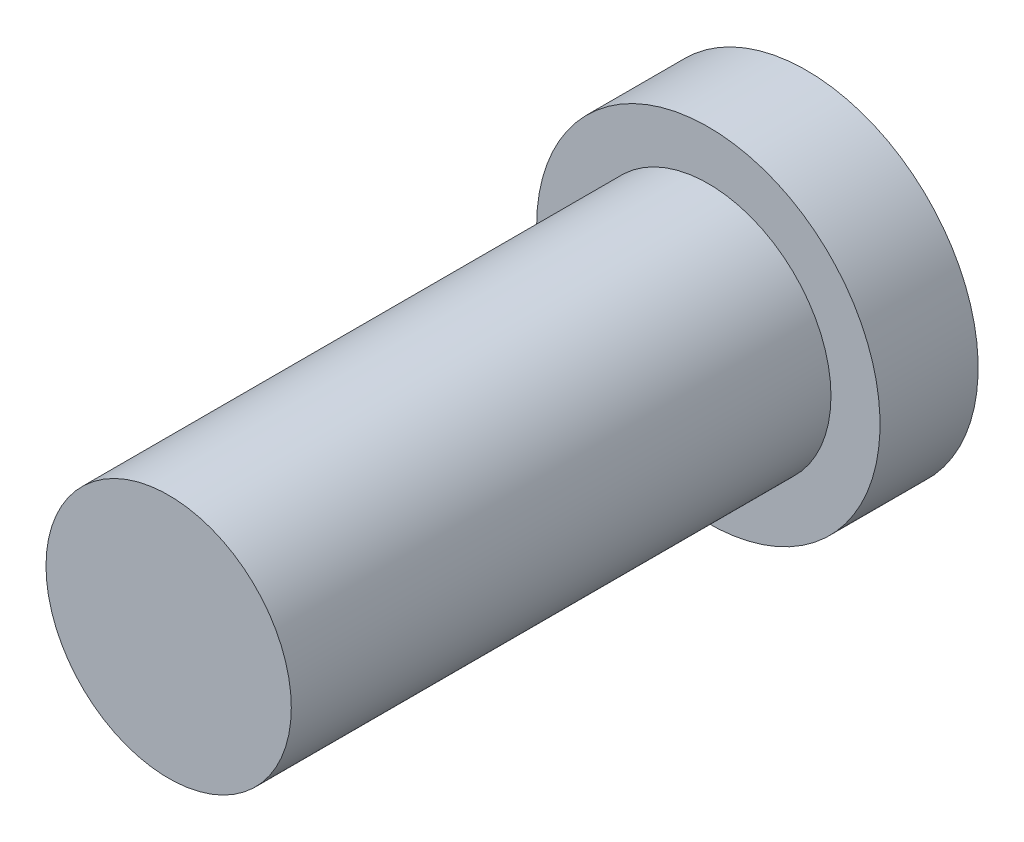
from build123d import *

# Parameters (mm, degrees)
ESBO_O1_R                = 5
RESSALTO_EXTRUS_O1_DEPTH = 22
ESBO_O2_R                = 7
RESSALTO_EXTRUS_O2_DEPTH = 4


with BuildPart() as part:
    # Esboço1 → Ressalto-extrusão1 (new body)
    with BuildSketch(Plane.XY):
        Circle(ESBO_O1_R)
    extrude(amount=RESSALTO_EXTRUS_O1_DEPTH)

    # Esboço2 → Ressalto-extrusão2 (add)
    with BuildSketch(Plane(origin=(0, 0, 0), x_dir=(-1, 0, 0), z_dir=(0, 0, -1))):
        Circle(ESBO_O2_R)
    extrude(amount=RESSALTO_EXTRUS_O2_DEPTH)


solid = part.part
